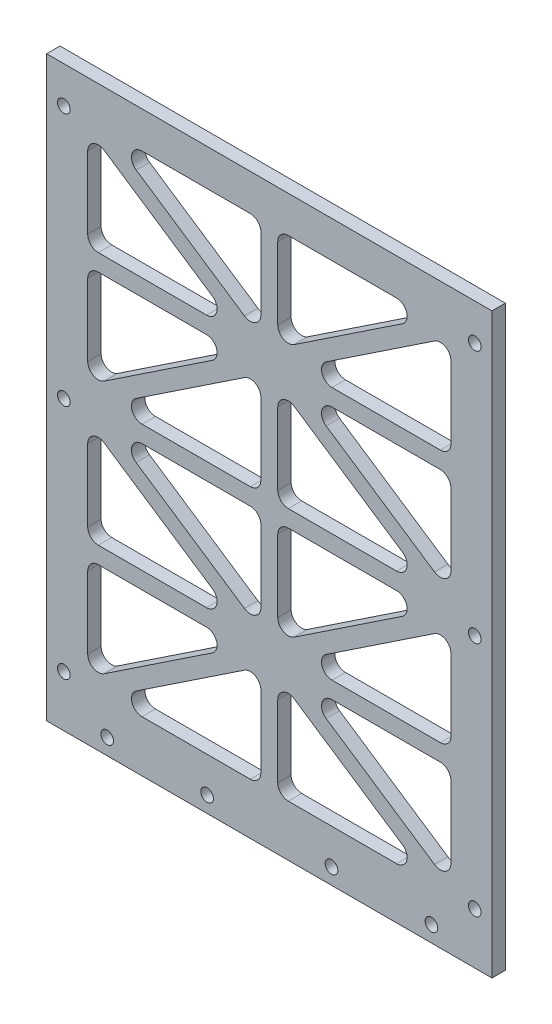
from build123d import *

# Parameters (mm, degrees)
SKETCH1_W                   = 105.470303733
SKETCH1_H                   = 273.610686589
SKETCH1_R                   = 3
BOSS_EXTRUDE2_DEPTH         = 6.35
CUTOUT_FILLETS_R            = 5
CUTOUT_FILLETS_OF_MIRROR2_R = 5


with BuildPart() as part:
    # Sketch1 → Boss-Extrude2 (new body)
    with BuildSketch(Plane.XY):
        with Locations((52.735151867, 0.297634424)):
            Rectangle(SKETCH1_W, SKETCH1_H)
        with Locations((29.45532979, -128.937258766)):
            Circle(SKETCH1_R, mode=Mode.SUBTRACT)
        with Locations((76.788897449, -128.937258766)):
            Circle(SKETCH1_R, mode=Mode.SUBTRACT)
        with Locations((97.306985108, 119.786891803)):
            Circle(SKETCH1_R, mode=Mode.SUBTRACT)
        with Locations((97.306985108, -0.213108197)):
            Circle(SKETCH1_R, mode=Mode.SUBTRACT)
        with Locations((97.306985108, -112.213108197)):
            Circle(SKETCH1_R, mode=Mode.SUBTRACT)
        Polygon((4, 119.786891803), (4, 71.260960171), (76.788897449, 119.786891803), align=None, mode=Mode.SUBTRACT)
        Polygon((86, 116.312823436), (13.211102551, 67.786891803), (86, 67.786891803), align=None, mode=Mode.SUBTRACT)
        Polygon((13.211102551, 59.786891803), (86, 59.786891803), (86, 11.260960171), align=None, mode=Mode.SUBTRACT)
        Polygon((76.788897449, 7.786891803), (4, 56.312823436), (4, 7.786891803), align=None, mode=Mode.SUBTRACT)
        Polygon((4, -0.213108197), (76.788897449, -0.213108197), (4, -48.739039829), align=None, mode=Mode.SUBTRACT)
        Polygon((86, -3.687176564), (13.211102551, -52.213108197), (86, -52.213108197), align=None, mode=Mode.SUBTRACT)
        Polygon((13.211102551, -60.213108197), (86, -60.213108197), (86, -108.739039829), align=None, mode=Mode.SUBTRACT)
        Polygon((4, -112.213108197), (4, -63.687176564), (76.788897449, -112.213108197), align=None, mode=Mode.SUBTRACT)
    boss_extrude2 = extrude(amount=BOSS_EXTRUDE2_DEPTH)

    # Cutout_Fillets
    cutout_fillets_edges = [part.edges().sort_by_distance(p)[0] for p in [
        (76.788897449, 119.786891803, 3.175),
        (4, 119.786891803, 3.175),
        (4, 71.260960171, 3.175),
        (86, 67.786891803, 3.175),
        (86, 116.312823436, 3.175),
        (13.211102551, 67.786891803, 3.175),
        (13.211102551, 59.786891803, 3.175),
        (86, 11.260960171, 3.175),
        (86, 59.786891803, 3.175),
        (4, 7.786891803, 3.175),
        (76.788897449, 7.786891803, 3.175),
        (4, 56.312823436, 3.175),
        (4, -0.213108197, 3.175),
        (4, -48.739039829, 3.175),
        (76.788897449, -0.213108197, 3.175),
        (86, -52.213108197, 3.175),
        (86, -3.687176564, 3.175),
        (13.211102551, -52.213108197, 3.175),
        (13.211102551, -60.213108197, 3.175),
        (86, -108.739039829, 3.175),
        (86, -60.213108197, 3.175),
        (4, -112.213108197, 3.175),
        (76.788897449, -112.213108197, 3.175),
        (4, -63.687176564, 3.175),
    ]]
    fillet(cutout_fillets_edges, radius=CUTOUT_FILLETS_R)

    # Mirror2: Boss-Extrude2 across plane
    add(boss_extrude2.mirror(Plane(origin=(0, 137.102977719, 6.35), x_dir=(0, 0, 1), z_dir=(1, 0, 0))))

    # Cutout_Fillets of Mirror2
    cutout_fillets_of_mirror2_edges = [part.edges().sort_by_distance(p)[0] for p in [
        (-76.788897449, 119.786891803, 3.175),
        (-4, 119.786891803, 3.175),
        (-4, 71.260960171, 3.175),
        (-86, 67.786891803, 3.175),
        (-86, 116.312823436, 3.175),
        (-13.211102551, 67.786891803, 3.175),
        (-13.211102551, 59.786891803, 3.175),
        (-86, 11.260960171, 3.175),
        (-86, 59.786891803, 3.175),
        (-4, 7.786891803, 3.175),
        (-76.788897449, 7.786891803, 3.175),
        (-4, 56.312823436, 3.175),
        (-4, -0.213108197, 3.175),
        (-4, -48.739039829, 3.175),
        (-76.788897449, -0.213108197, 3.175),
        (-86, -52.213108197, 3.175),
        (-86, -3.687176564, 3.175),
        (-13.211102551, -52.213108197, 3.175),
        (-13.211102551, -60.213108197, 3.175),
        (-86, -108.739039829, 3.175),
        (-86, -60.213108197, 3.175),
        (-4, -112.213108197, 3.175),
        (-76.788897449, -112.213108197, 3.175),
        (-4, -63.687176564, 3.175),
    ]]
    fillet(cutout_fillets_of_mirror2_edges, radius=CUTOUT_FILLETS_OF_MIRROR2_R)


solid = part.part
